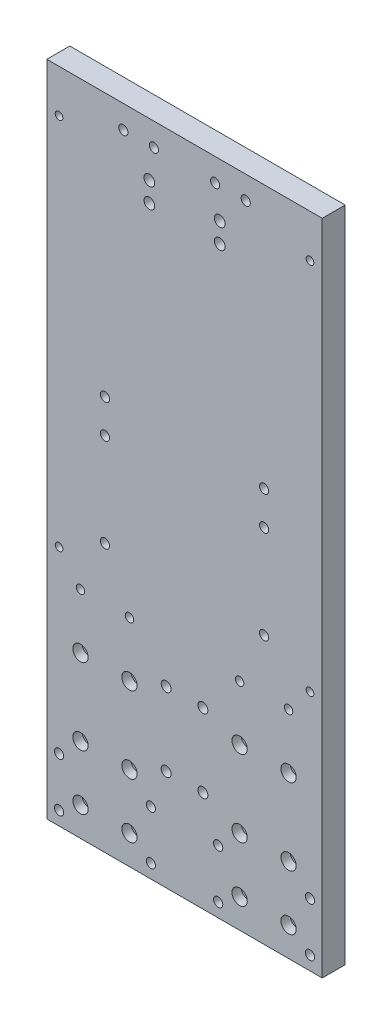
from build123d import *

# Parameters (mm, degrees)
SKIZZE1_W                        = 180
SKIZZE1_H                        = 430
AUFSATZ_LINEAR_AUSTRAGEN1_DEPTH  = 15
SKIZZE2_R                        = 2.75
SCHNITT_LINEAR_AUSTRAGEN1_DEPTH  = 40
SKIZZE3_R                        = 3.25
SCHNITT_LINEAR_AUSTRAGEN2_DEPTH  = 40
SKIZZE6_R                        = 3.5
SCHNITT_LINEAR_AUSTRAGEN5_DEPTH  = 30
SKIZZE7_R                        = 3
SCHNITT_LINEAR_AUSTRAGEN6_DEPTH  = 40
SKIZZE8_R                        = 3
SCHNITT_LINEAR_AUSTRAGEN7_DEPTH  = 40
SKIZZE9_R                        = 5
SCHNITT_LINEAR_AUSTRAGEN8_DEPTH  = 6
SKIZZE11_R                       = 3
SCHNITT_LINEAR_AUSTRAGEN10_DEPTH = 40
SKIZZE10_R                       = 5.5
SCHNITT_LINEAR_AUSTRAGEN9_DEPTH  = 7
SKIZZE12_R                       = 2.5
SCHNITT_LINEAR_AUSTRAGEN11_DEPTH = 30


with BuildPart() as part:
    # Skizze1 → Aufsatz-Linear austragen1 (new body)
    with BuildSketch(Plane.XY):
        with Locations((0, 215)):
            Rectangle(SKIZZE1_W, SKIZZE1_H)
    extrude(amount=AUFSATZ_LINEAR_AUSTRAGEN1_DEPTH)

    # Skizze2 → Schnitt-Linear austragen1 (cut)
    with BuildSketch(Plane.XY.offset(15)):
        with Locations((36, 19)):
            Circle(SKIZZE2_R)
        with Locations((68, 19)):
            Circle(SKIZZE2_R)
        with Locations(Location((68, 55, 0), (0, 0, 180))):
            Circle(SKIZZE2_R)
        with Locations(Location((36, 55, 0), (0, 0, 180))):
            Circle(SKIZZE2_R)
        with Locations(Location((-36, 19, 0), (0, 0, 180))):
            Circle(SKIZZE2_R)
        with Locations(Location((-68, 19, 0), (0, 0, 180))):
            Circle(SKIZZE2_R)
        with Locations((-68, 55)):
            Circle(SKIZZE2_R)
        with Locations((-36, 55)):
            Circle(SKIZZE2_R)
        with Locations(Location((-36, 105, 0), (0, 0, 180))):
            Circle(SKIZZE2_R)
        with Locations(Location((-68, 105, 0), (0, 0, 180))):
            Circle(SKIZZE2_R)
        with Locations((-68, 141)):
            Circle(SKIZZE2_R)
        with Locations((-36, 141)):
            Circle(SKIZZE2_R)
        with Locations((36, 105)):
            Circle(SKIZZE2_R)
        with Locations((68, 105)):
            Circle(SKIZZE2_R)
        with Locations(Location((68, 141, 0), (0, 0, 180))):
            Circle(SKIZZE2_R)
        with Locations(Location((36, 141, 0), (0, 0, 180))):
            Circle(SKIZZE2_R)
    extrude(amount=-SCHNITT_LINEAR_AUSTRAGEN1_DEPTH, mode=Mode.SUBTRACT)

    # Skizze3 → Schnitt-Linear austragen2 (cut)
    with BuildSketch(Plane.XY.offset(15)):
        with Locations((12, 66)):
            Circle(SKIZZE3_R)
        with Locations((12, 114)):
            Circle(SKIZZE3_R)
        with Locations(Location((-12, 114, 0), (0, 0, 180))):
            Circle(SKIZZE3_R)
        with Locations(Location((-12, 66, 0), (0, 0, 180))):
            Circle(SKIZZE3_R)
    extrude(amount=-SCHNITT_LINEAR_AUSTRAGEN2_DEPTH, mode=Mode.SUBTRACT)

    # Skizze6 → Schnitt-Linear austragen5 (cut)
    with BuildSketch(Plane(origin=(0, 0, 0), x_dir=(-1, 0, 0), z_dir=(0, 0, -1))):
        with Locations((23, 395)):
            Circle(SKIZZE6_R)
        with Locations((23, 382)):
            Circle(SKIZZE6_R)
        with Locations((-23, 382)):
            Circle(SKIZZE6_R)
        with Locations((-23, 395)):
            Circle(SKIZZE6_R)
    extrude(amount=-SCHNITT_LINEAR_AUSTRAGEN5_DEPTH, mode=Mode.SUBTRACT)

    # Skizze7 → Schnitt-Linear austragen6 (cut)
    with BuildSketch(Plane.XY.offset(15)):
        with Locations((20, 415)):
            Circle(SKIZZE7_R)
        with Locations((40, 415)):
            Circle(SKIZZE7_R)
        with Locations(Location((-40, 415, 0), (0, 0, 180))):
            Circle(SKIZZE7_R)
        with Locations(Location((-20, 415, 0), (0, 0, 180))):
            Circle(SKIZZE7_R)
    extrude(amount=-SCHNITT_LINEAR_AUSTRAGEN6_DEPTH, mode=Mode.SUBTRACT)

    # Skizze8 → Schnitt-Linear austragen7 (cut)
    with BuildSketch(Plane(origin=(0, 0, 0), x_dir=(-1, 0, 0), z_dir=(0, 0, -1))):
        with Locations((22, 9)):
            Circle(SKIZZE8_R)
        with Locations((82, 9)):
            Circle(SKIZZE8_R)
        with Locations((22, 41)):
            Circle(SKIZZE8_R)
        with Locations((82, 41)):
            Circle(SKIZZE8_R)
        with Locations((-82, 41)):
            Circle(SKIZZE8_R)
        with Locations((-82, 9)):
            Circle(SKIZZE8_R)
        with Locations((-22, 9)):
            Circle(SKIZZE8_R)
        with Locations((-22, 41)):
            Circle(SKIZZE8_R)
    extrude(amount=-SCHNITT_LINEAR_AUSTRAGEN7_DEPTH, mode=Mode.SUBTRACT)

    # Skizze9 → Schnitt-Linear austragen8 (cut)
    with BuildSketch(Plane.XY.offset(15)):
        with Locations((68, 55)):
            Circle(SKIZZE9_R)
        with Locations((68, 19)):
            Circle(SKIZZE9_R)
        with Locations((36, 19)):
            Circle(SKIZZE9_R)
        with Locations((36, 55)):
            Circle(SKIZZE9_R)
        with Locations(Location((-68, 19, 0), (0, 0, 180))):
            Circle(SKIZZE9_R)
        with Locations(Location((-36, 19, 0), (0, 0, 180))):
            Circle(SKIZZE9_R)
        with Locations(Location((-68, 55, 0), (0, 0, 180))):
            Circle(SKIZZE9_R)
        with Locations(Location((-36, 55, 0), (0, 0, 180))):
            Circle(SKIZZE9_R)
        with Locations((68, 105)):
            Circle(SKIZZE9_R)
        with Locations((36, 105)):
            Circle(SKIZZE9_R)
        with Locations((-36, 105)):
            Circle(SKIZZE9_R)
        with Locations((-68, 105)):
            Circle(SKIZZE9_R)
    extrude(amount=-SCHNITT_LINEAR_AUSTRAGEN8_DEPTH, mode=Mode.SUBTRACT)

    # Skizze11 → Schnitt-Linear austragen10 (cut)
    with BuildSketch(Plane(origin=(0, 0, 0), x_dir=(-1, 0, 0), z_dir=(0, 0, -1))):
        with Locations((-52, 175)):
            Circle(SKIZZE11_R)
        with Locations((-52, 236)):
            Circle(SKIZZE11_R)
        with Locations((52, 236)):
            Circle(SKIZZE11_R)
        with Locations((52, 175)):
            Circle(SKIZZE11_R)
        with Locations((-52, 258)):
            Circle(SKIZZE11_R)
        with Locations((52, 258)):
            Circle(SKIZZE11_R)
    extrude(amount=-SCHNITT_LINEAR_AUSTRAGEN10_DEPTH, mode=Mode.SUBTRACT)

    # Skizze10 → Schnitt-Linear austragen9 (cut)
    with BuildSketch(Plane(origin=(0, 0, 0), x_dir=(-1, 0, 0), z_dir=(0, 0, -1))):
        with Locations((12, 114)):
            Circle(SKIZZE10_R)
        with Locations((-12, 114)):
            Circle(SKIZZE10_R)
        with Locations((52, 175)):
            Circle(SKIZZE10_R)
        with Locations((-52, 175)):
            Circle(SKIZZE10_R)
    extrude(amount=-SCHNITT_LINEAR_AUSTRAGEN9_DEPTH, mode=Mode.SUBTRACT)

    # Skizze12 → Schnitt-Linear austragen11 (cut)
    with BuildSketch(Plane(origin=(0, 0, 0), x_dir=(-1, 0, 0), z_dir=(0, 0, -1))):
        with Locations((82, 402)):
            Circle(SKIZZE12_R)
        with Locations((82, 158)):
            Circle(SKIZZE12_R)
        with Locations((-82, 158)):
            Circle(SKIZZE12_R)
        with Locations((-82, 402)):
            Circle(SKIZZE12_R)
    extrude(amount=-SCHNITT_LINEAR_AUSTRAGEN11_DEPTH, mode=Mode.SUBTRACT)


solid = part.part
